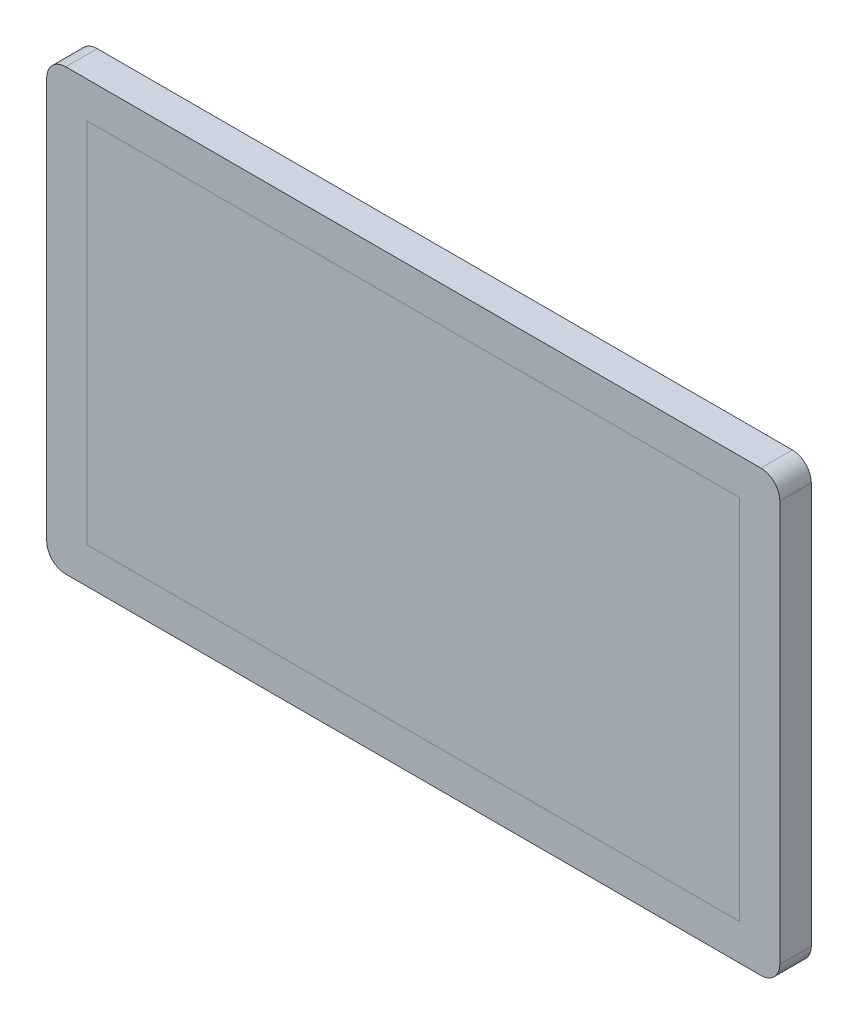
from build123d import *

# Parameters (mm, degrees)
BOSS_EXTRUDE1_DEPTH = 16.6


with BuildPart() as part:
    # Sketch1 → Boss-Extrude1 (new body)
    with BuildSketch(Plane.XY):
        with BuildLine():
            Line((-183.3, 115.85), (183.3, 115.85))
            ThreePointArc((183.3, 115.85), (190.371067812, 112.921067812), (193.3, 105.85))
            Line((193.3, 105.85), (193.3, -105.85))
            ThreePointArc((193.3, -105.85), (190.371067812, -112.921067812), (183.3, -115.85))
            Line((183.3, -115.85), (-183.3, -115.85))
            ThreePointArc((-183.3, -115.85), (-190.371067812, -112.921067812), (-193.3, -105.85))
            Line((-193.3, -105.85), (-193.3, 105.85))
            ThreePointArc((-193.3, 105.85), (-190.371067812, 112.921067812), (-183.3, 115.85))
        make_face()
    extrude(amount=BOSS_EXTRUDE1_DEPTH)


solid = part.part
